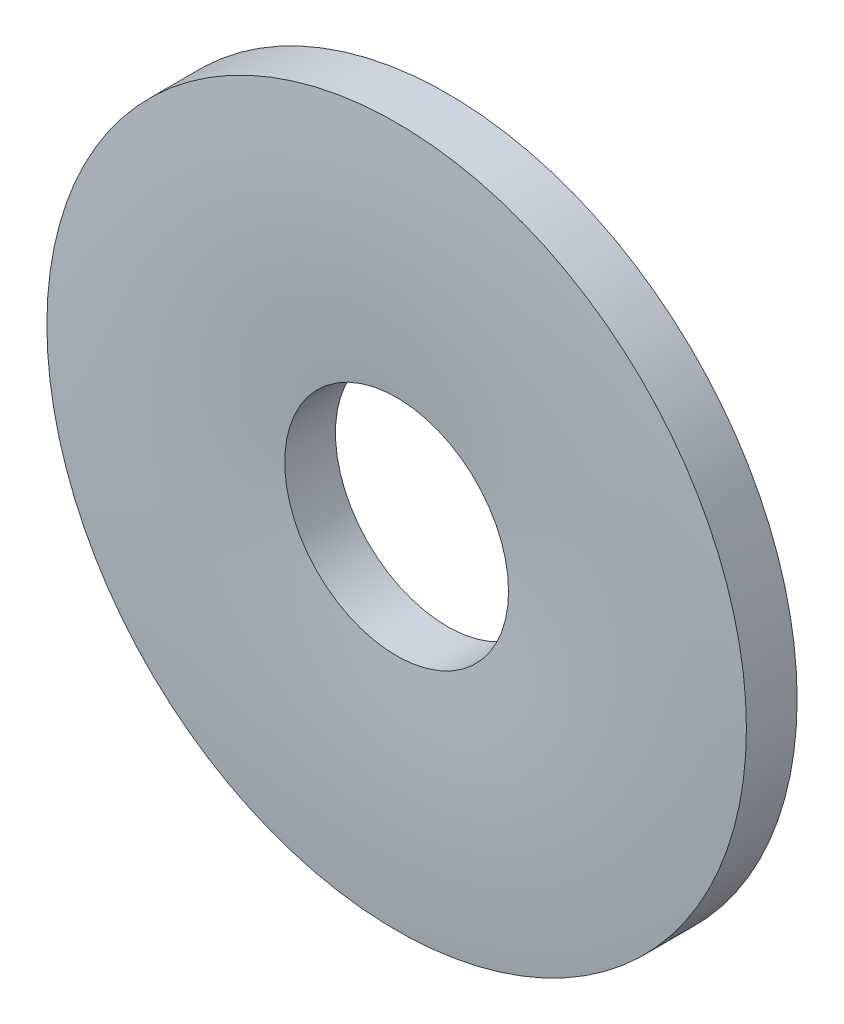
from build123d import *


with BuildPart() as part:
    # Sketch3 → Revolve1 (revolve)
    with BuildSketch(Plane(origin=(0, 0, 0), x_dir=(0, 0, -1), z_dir=(1, 0, 0)), mode=Mode.PRIVATE) as revolve1_sk:
        with BuildLine():
            Line((0.8, 10), (-0.65008, 10))
            ThreePointArc((-0.65008, 10), (-0.8, 6.6), (-0.65008, 3.2))
            Line((-0.65008, 3.2), (0.8, 3.2))
            Line((0.8, 3.2), (0.8, 10))
        make_face()
    revolve(revolve1_sk.sketch.rotate(Axis((0, 0, 0.8), (0, 0, -1)), 90), axis=Axis((0, 0, 0.8), (0, 0, -1)))


solid = part.part
